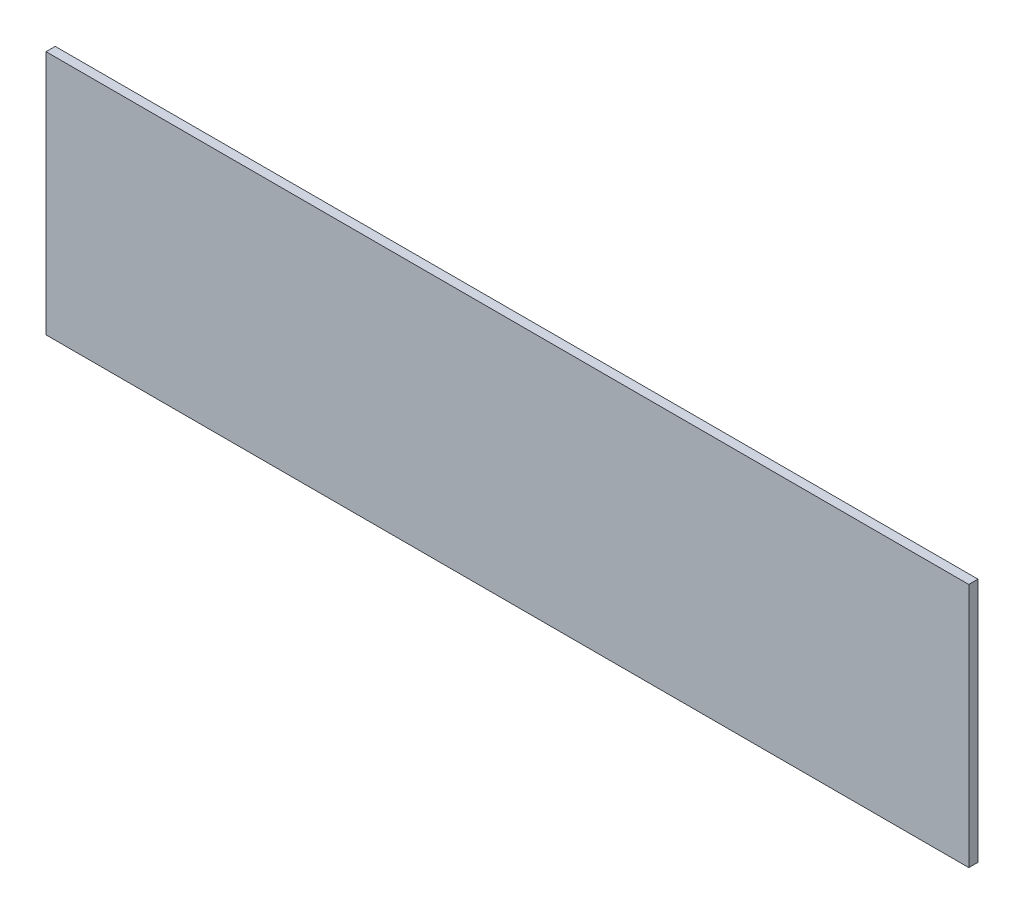
from build123d import *

# Parameters (mm, degrees)
ESQUISSE1_W        = 301
ESQUISSE1_H        = 80
BOSS_EXTRU_1_DEPTH = 3


with BuildPart() as part:
    # Esquisse1 → Boss.-Extru.1 (new body)
    with BuildSketch(Plane.XY):
        with Locations((-150.5, 40)):
            Rectangle(ESQUISSE1_W, ESQUISSE1_H)
    extrude(amount=BOSS_EXTRU_1_DEPTH)


solid = part.part
